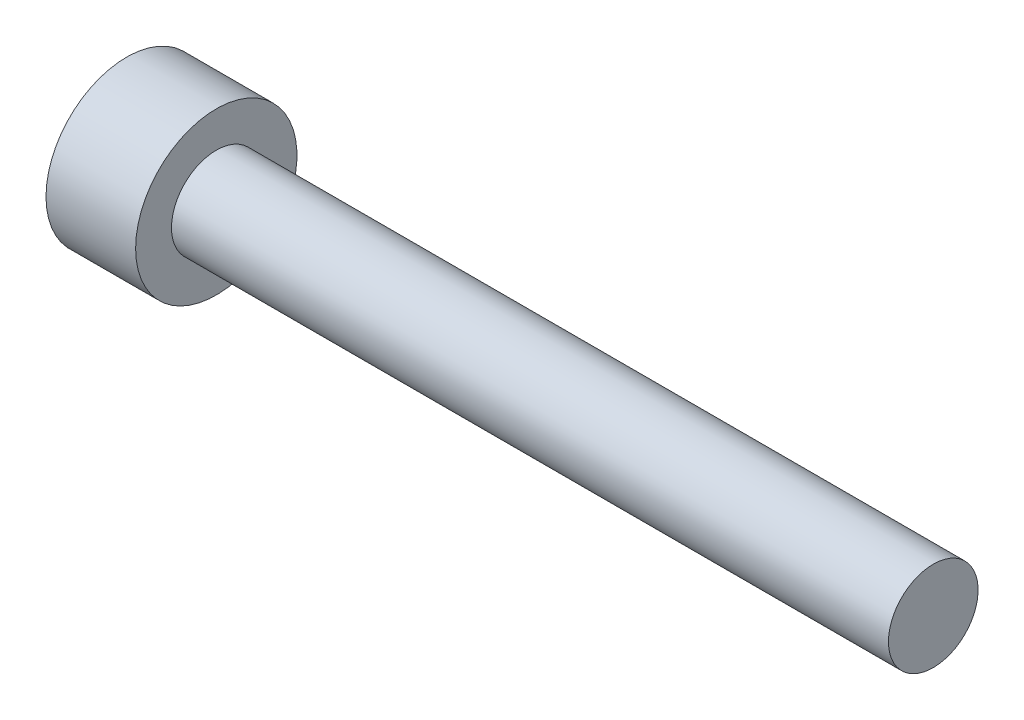
from build123d import *

# Parameters (mm, degrees)
SOCKET_DEPTH = 1.25


with BuildPart() as part:
    # Screw Sketch → Screw (revolve)
    with BuildSketch(Plane.XY):
        Polygon((-2.5, 0), (-2.5, 2.25), (0, 2.25), (0, 1.25), (20, 1.25), (20, 0), align=None)
    revolve(axis=Axis((-400, 0, 0), (1, 0, 0)))

    # Socket Sketch → Socket (cut)
    with BuildSketch(Plane(origin=(-2.5, 0, 0), x_dir=(0, 0, -1), z_dir=(1, 0, 0))):
        Polygon((1.154700538, 0), (0.577350269, 1), (-0.577350269, 1), (-1.154700538, 0), (-0.577350269, -1), (0.577350269, -1), align=None)
    extrude(amount=SOCKET_DEPTH, mode=Mode.SUBTRACT)


solid = part.part
